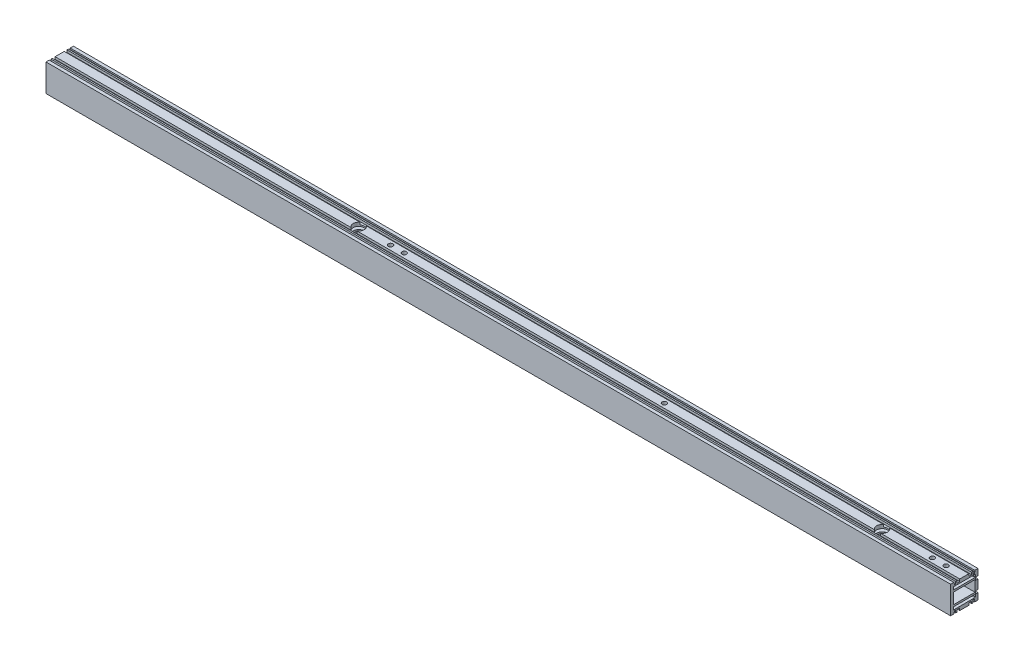
from build123d import *

# Parameters (mm, degrees)
SKETCH_1_W              = 23.5
SKETCH_1_H              = 12
EXTRUDE_1_DEPTH         = 495.5
HOLE_WIZARD_M6_1_D      = 5
HOLE_WIZARD_M6_1_DEPTH  = 19
HOLE_WIZARD_M6_1_TIP    = 1.502151548
HOLE_WIZARD_M6_2_D      = 5
HOLE_WIZARD_M6_2_DEPTH  = 19
HOLE_WIZARD_M6_2_TIP    = 1.502151548
HOLE_WIZARD_M6_3_D      = 5
HOLE_WIZARD_M6_3_DEPTH  = 19
HOLE_WIZARD_M6_3_TIP    = 1.502151548
HOLE_WIZARD_M4_1_D      = 3.3
HOLE_WIZARD_M4_1_DEPTH  = 15
HOLE_WIZARD_M4_1_TIP    = 0.991420021
HOLE_WIZARD_12_0_12_1_D = 12


with BuildPart() as part:
    # 草图1 → 凸台-拉伸1 (new, symmetric)
    with BuildSketch(Plane(origin=(0, 0, 0), x_dir=(0, 0, -1), z_dir=(1, 0, 0))):
        Polygon((-15, 15), (-11.5, 15), (-11.5, 13.5), (-11, 13.5), (-11, 12), (-9.5, 12), (-9.5, 15), (-8, 15), (-8, 12.5), (-5, 12.5), (-5, 15), (5, 15), (5, 12.5), (8, 12.5), (8, 15), (9.5, 15), (9.5, 12), (11, 12), (11, 13.5), (11.5, 13.5), (11.5, 15), (15, 15), (15, 8), (12.5, 8), (12.5, 5), (15, 5), (15, -5), (12.5, -5), (12.5, -8), (15, -8), (15, -15), (11.5, -15), (11.5, -13.5), (11, -13.5), (11, -12), (9.5, -12), (9.5, -15), (8, -15), (8, -12.5), (5, -12.5), (5, -15), (-5, -15), (-5, -12.5), (-8, -12.5), (-8, -15), (-9.5, -15), (-9.5, -12), (-11, -12), (-11, -13.5), (-11.5, -13.5), (-11.5, -15), (-15, -15), align=None)
        with BuildLine():
            Line((12, -10.5), (12, -8.5))
            ThreePointArc((12, -8.5), (11.853553391, -8.146446609), (11.5, -8))
            Line((11.5, -8), (-11.5, -8))
            ThreePointArc((-11.5, -8), (-11.853553391, -8.146446609), (-12, -8.5))
            Line((-12, -8.5), (-12, -10.5))
            ThreePointArc((-12, -10.5), (-11.853553391, -10.853553391), (-11.5, -11))
            Line((-11.5, -11), (11.5, -11))
            ThreePointArc((11.5, -11), (11.853553391, -10.853553391), (12, -10.5))
        make_face(mode=Mode.SUBTRACT)
        with BuildLine():
            Line((-11.5, 11), (11.5, 11))
            ThreePointArc((11.5, 11), (11.853553391, 10.853553391), (12, 10.5))
            Line((12, 10.5), (12, 8.5))
            ThreePointArc((12, 8.5), (11.853553391, 8.146446609), (11.5, 8))
            Line((11.5, 8), (-11.5, 8))
            ThreePointArc((-11.5, 8), (-11.853553391, 8.146446609), (-12, 8.5))
            Line((-12, 8.5), (-12, 10.5))
            ThreePointArc((-12, 10.5), (-11.853553391, 10.853553391), (-11.5, 11))
        make_face(mode=Mode.SUBTRACT)
        Rectangle(SKETCH_1_W, SKETCH_1_H, mode=Mode.SUBTRACT)
    extrude(amount=EXTRUDE_1_DEPTH, both=True)

    # M6 螺纹孔1
    with Locations(Plane(origin=(0, 0, -15), x_dir=(-1, 0, 0), z_dir=(0, 0, -1))):
        with Locations((445.5, 0), (430.5, 0), (370.5, 0), (266.5, 0), (394.5, 0)):
            Hole(HOLE_WIZARD_M6_1_D / 2, depth=HOLE_WIZARD_M6_1_DEPTH)
            with Locations((0, 0, -(HOLE_WIZARD_M6_1_DEPTH + HOLE_WIZARD_M6_1_TIP / 2))):  # 118° drill point
                Cone(0, HOLE_WIZARD_M6_1_D / 2, HOLE_WIZARD_M6_1_TIP, mode=Mode.SUBTRACT)

    # M6 螺纹孔2
    with Locations(Plane(origin=(0, 15, 0), x_dir=(1, 0, 0), z_dir=(0, 1, 0))):
        with Locations((-133, 0), (-118, 0), (460.5, 0), (475.5, 0), (167, 0)):
            Hole(HOLE_WIZARD_M6_2_D / 2, depth=HOLE_WIZARD_M6_2_DEPTH)
            with Locations((0, 0, -(HOLE_WIZARD_M6_2_DEPTH + HOLE_WIZARD_M6_2_TIP / 2))):  # 118° drill point
                Cone(0, HOLE_WIZARD_M6_2_D / 2, HOLE_WIZARD_M6_2_TIP, mode=Mode.SUBTRACT)

    # M6 螺纹孔3
    with Locations(Plane(origin=(0, -15, 0), x_dir=(-1, 0, 0), z_dir=(0, -1, 0))):
        with Locations((445.5, 0), (430.5, 0), (-230.5, 0), (-245.5, 0), (-460.5, 0), (-475.5, 0)):
            Hole(HOLE_WIZARD_M6_3_D / 2, depth=HOLE_WIZARD_M6_3_DEPTH)
            with Locations((0, 0, -(HOLE_WIZARD_M6_3_DEPTH + HOLE_WIZARD_M6_3_TIP / 2))):  # 118° drill point
                Cone(0, HOLE_WIZARD_M6_3_D / 2, HOLE_WIZARD_M6_3_TIP, mode=Mode.SUBTRACT)

    # M4 螺纹孔1
    with Locations(Plane(origin=(0, 0, -15), x_dir=(-1, 0, 0), z_dir=(0, 0, -1))):
        with Locations((191, 0), (236, 0), (341, 0), (296, 0)):
            Hole(HOLE_WIZARD_M4_1_D / 2, depth=HOLE_WIZARD_M4_1_DEPTH)
            with Locations((0, 0, -(HOLE_WIZARD_M4_1_DEPTH + HOLE_WIZARD_M4_1_TIP / 2))):  # 118° drill point
                Cone(0, HOLE_WIZARD_M4_1_D / 2, HOLE_WIZARD_M4_1_TIP, mode=Mode.SUBTRACT)

    # Ø12.0 (12) 直径孔1 (through all)
    with Locations(Plane(origin=(0, -15, 0), x_dir=(-1, 0, 0), z_dir=(0, -1, 0))):
        with Locations((168, 0), (-405.5, 0)):
            Hole(HOLE_WIZARD_12_0_12_1_D / 2)


solid = part.part
